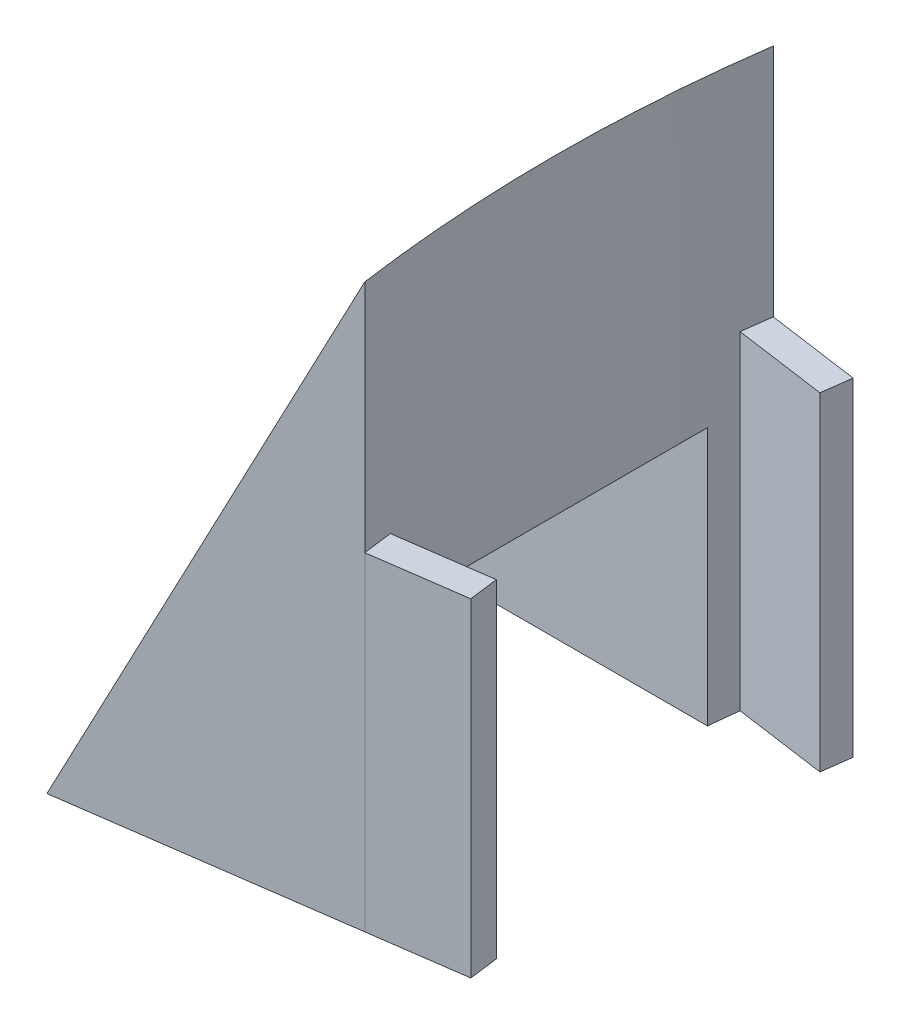
from build123d import *

# Parameters (mm, degrees)
REVOLVE1_ANGLE           = 8
REVOLVE1_OTHER_WAY_ANGLE = 8
CUT_EXTRUDE1_DEPTH       = 15.5
CUT_EXTRUDE1_DEPTH_BACK  = 15.5
BOSS_EXTRUDE1_DEPTH      = 35
BOSS_EXTRUDE1_2_DEPTH    = 35


with BuildPart() as part:
    # Sketch4 → Revolve1 (revolve)
    with BuildSketch(Plane.XY):
        Polygon((-156.4, 0), (-156.4, 60), (-186.4, 0), align=None)
    revolve(axis=Axis((0, 70, 0), (0, -1, 0)), revolution_arc=REVOLVE1_ANGLE)

    # Sketch4 → Revolve1 other way (revolve)
    with BuildSketch(Plane.XY):
        Polygon((-156.4, 0), (-156.4, 60), (-186.4, 0), align=None)
    revolve(axis=Axis((0, 70, 0), (0, 1, 0)), revolution_arc=REVOLVE1_OTHER_WAY_ANGLE)

    # Sketch6 → Cut-Extrude1 (cut, two sides: drawn at the far end of the back side and taken through both)
    with BuildSketch(Plane.XY.offset(-CUT_EXTRUDE1_DEPTH_BACK)):
        Polygon((-154.877925951, 28.284271247), (-183.162197199, 0), (-154.877925951, 0), align=None)
    extrude(amount=CUT_EXTRUDE1_DEPTH + CUT_EXTRUDE1_DEPTH_BACK, mode=Mode.SUBTRACT)


with BuildPart() as body_2:
    # Sketch7 → Boss-Extrude1 (new body)
    with BuildSketch(Plane.XZ):
        Polygon((-154.877925951, 21.76667299), (-155.285599305, 18.637130911), (-145.382918617, 17.245399902), (-144.975245264, 20.374941981), align=None)
    extrude(amount=-BOSS_EXTRUDE1_DEPTH)


with BuildPart() as body_3:
    # Sketch7 → Boss-Extrude1 2 (new body)
    with BuildSketch(Plane.XZ):
        Polygon((-154.877925951, -21.76667299), (-155.285599305, -18.637130911), (-145.382918617, -17.245399902), (-144.975245264, -20.374941981), align=None)
    extrude(amount=-BOSS_EXTRUDE1_2_DEPTH)


solid = Compound([part.part, body_2.part, body_3.part])
